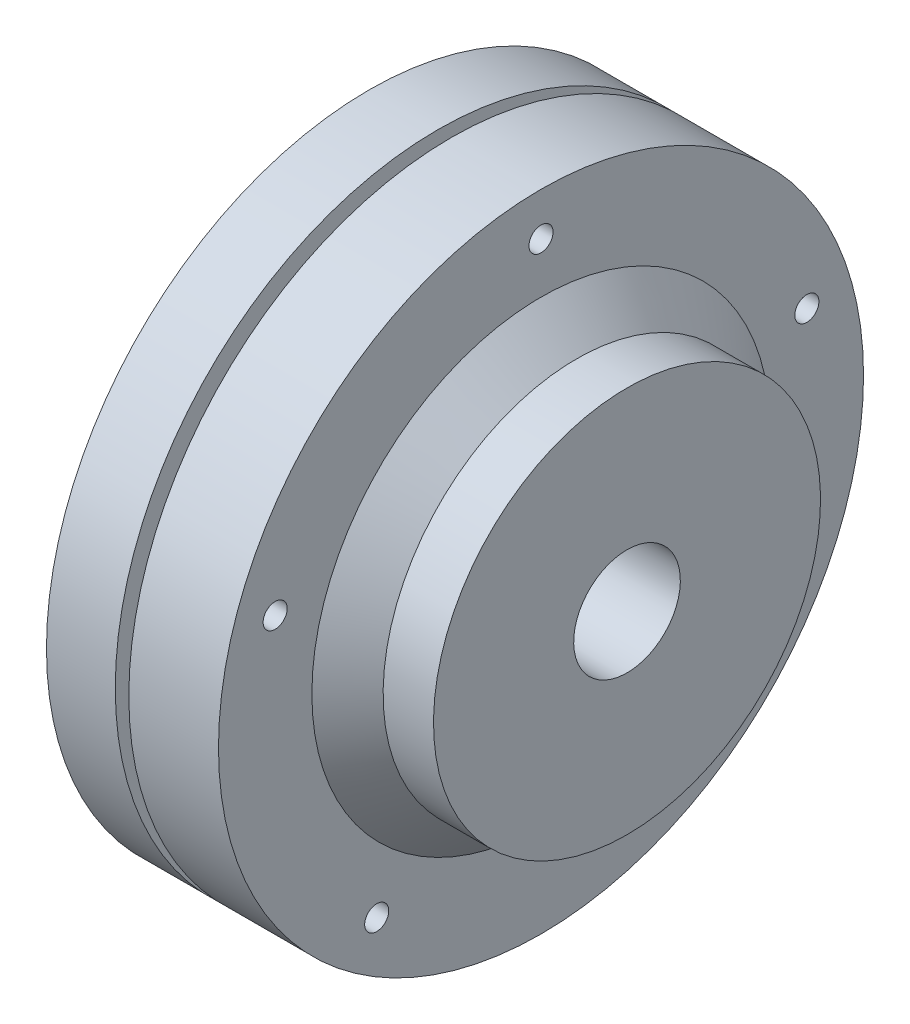
from build123d import *

# Parameters (mm, degrees)
SKETCH2_R                                      = 23.8125
SKETCH2_R_2                                    = 1.4732
BOSS_EXTRUDE1_DEPTH                            = 5.08
CSK_FOR_4_FLAT_HEAD_MACHINE_SCREW1_D           = 3.2639
CSK_FOR_4_FLAT_HEAD_MACHINE_SCREW1_CSINK_D     = 5.715
CSK_FOR_4_FLAT_HEAD_MACHINE_SCREW1_CSINK_ANGLE = 82
BOSS_EXTRUDE2_DEPTH                            = 5.08
BOSS_EXTRUDE2_DEPTH_BACK                       = 3.175
BOSS_EXTRUDE3_START                            = 0.508
SKETCH5_R                                      = 23.8125
BOSS_EXTRUDE3_DEPTH                            = 3.937
SKETCH6_R                                      = 23.8125
BOSS_EXTRUDE4_DEPTH                            = 2.682999968
SKETCH13_W                                     = 0.889
SKETCH13_H                                     = 6.619999968
F_50_0_07_DIAMETER_HOLE1_AT_2_COUNT            = 2
F_50_0_07_DIAMETER_HOLE1_AT_2_PITCH            = 24.260836288
F_50_0_07_DIAMETER_HOLE1_AT_3_COUNT            = 2
F_50_0_07_DIAMETER_HOLE1_AT_3_PITCH            = 39.25485771
F_50_0_07_DIAMETER_HOLE1_AT_4_COUNT            = 2
F_50_0_07_DIAMETER_HOLE1_AT_4_PITCH            = 39.25485771
F_50_0_07_DIAMETER_HOLE1_AT_5_COUNT            = 2
F_50_0_07_DIAMETER_HOLE1_AT_5_PITCH            = 24.260836288
SKETCH15_R                                     = 3.937
CUT_EXTRUDE1_DEPTH                             = 39.690732902


with BuildPart() as part:
    # Sketch2 → Boss-Extrude1 (new body)
    with BuildSketch(Plane.ZY):
        Circle(SKETCH2_R)
        with Locations((19.627428855, 6.377338221)):
            Circle(SKETCH2_R_2, mode=Mode.SUBTRACT)
        with Locations((12.130418144, -16.696088221)):
            Circle(SKETCH2_R_2, mode=Mode.SUBTRACT)
        with Locations((-12.130418144, -16.696088221)):
            Circle(SKETCH2_R_2, mode=Mode.SUBTRACT)
        with Locations((-19.627428855, 6.377338221)):
            Circle(SKETCH2_R_2, mode=Mode.SUBTRACT)
        with Locations((0, 20.6375)):
            Circle(SKETCH2_R_2, mode=Mode.SUBTRACT)
    extrude(amount=BOSS_EXTRUDE1_DEPTH)

    # CSK for #4 Flat Head Machine Screw1 (through all)
    with Locations(Plane.ZY.offset(5.08)):
        with Locations((0, 20.6375), (-19.627428855, 6.377338221), (-12.130418144, -16.696088221), (12.130418144, -16.696088221), (19.627428855, 6.377338221)):
            CounterSinkHole(CSK_FOR_4_FLAT_HEAD_MACHINE_SCREW1_D / 2, CSK_FOR_4_FLAT_HEAD_MACHINE_SCREW1_CSINK_D / 2, counter_sink_angle=CSK_FOR_4_FLAT_HEAD_MACHINE_SCREW1_CSINK_ANGLE)

    # Sketch1 → Boss-Extrude2 (add, two sides: drawn at the far end of the back side and taken through both)
    with BuildSketch(Plane.ZY.offset(-BOSS_EXTRUDE2_DEPTH_BACK)):
        with BuildLine():
            ThreePointArc((-19.77483561, 1.99784305), (-18.90272379, -6.141867272), (-14.823875388, -13.239645718))
            ThreePointArc((-14.823875388, -13.239645718), (-14.519423669, -13.403769568), (-14.180467851, -13.33494776))
            ThreePointArc((-14.180467851, -13.33494776), (-9.816307606, -13.510988315), (-8.300283408, -17.607151831))
            ThreePointArc((-8.300283408, -17.607151831), (-8.260993728, -17.950785078), (-8.010821916, -18.189618811))
            ThreePointArc((-8.010821916, -18.189618811), (0, -19.8755), (8.010821916, -18.189618811))
            ThreePointArc((8.010821916, -18.189618811), (8.260993728, -17.950785078), (8.300283408, -17.607151831))
            ThreePointArc((8.300283408, -17.607151831), (9.816307606, -13.510988315), (14.180467851, -13.33494776))
            ThreePointArc((14.180467851, -13.33494776), (14.519423669, -13.403769568), (14.823875388, -13.239645718))
            ThreePointArc((14.823875388, -13.239645718), (18.90272379, -6.141867272), (19.77483561, 1.99784305))
            ThreePointArc((19.77483561, 1.99784305), (19.624998573, 2.309574265), (19.310325113, 2.453129484))
            ThreePointArc((19.310325113, 2.453129484), (15.88311935, 5.160738315), (17.064294516, 9.365700877))
            ThreePointArc((17.064294516, 9.365700877), (17.234491052, 9.666799908), (17.172480751, 10.007067758))
            ThreePointArc((17.172480751, 10.007067758), (11.682525782, 16.079617272), (4.210698613, 19.42435372))
            ThreePointArc((4.210698613, 19.42435372), (3.86792242, 19.378180473), (3.634153846, 19.123269231))
            ThreePointArc((3.634153846, 19.123269231), (0, 16.7005), (-3.634153846, 19.123269231))
            ThreePointArc((-3.634153846, 19.123269231), (-3.86792242, 19.378180473), (-4.210698613, 19.42435372))
            ThreePointArc((-4.210698613, 19.42435372), (-11.682525782, 16.079617272), (-17.172480751, 10.007067758))
            ThreePointArc((-17.172480751, 10.007067758), (-17.234491052, 9.666799908), (-17.064294516, 9.365700877))
            ThreePointArc((-17.064294516, 9.365700877), (-15.88311935, 5.160738315), (-19.310325113, 2.453129484))
            ThreePointArc((-19.310325113, 2.453129484), (-19.624998573, 2.309574265), (-19.77483561, 1.99784305))
        make_face()
    extrude(amount=BOSS_EXTRUDE2_DEPTH + BOSS_EXTRUDE2_DEPTH_BACK)


with BuildPart() as body_2:
    # Sketch5 → Boss-Extrude3 (new body)
    with BuildSketch(Plane(origin=(3.175, 0, 0), x_dir=(0, 0, -1), z_dir=(1, 0, 0)).offset(BOSS_EXTRUDE3_START)):
        with Locations(Location((0, 0, 0), (0, 0, 180))):
            Circle(SKETCH5_R)
    extrude(amount=BOSS_EXTRUDE3_DEPTH)

    # Sketch6 → Boss-Extrude4 (add)
    with BuildSketch(Plane.ZY.offset(-3.683)):
        Circle(SKETCH6_R)
        with BuildLine():
            ThreePointArc((-4.372131148, 20.169057377), (-12.130418144, 16.696088221), (-17.83085062, 10.390725308))
            ThreePointArc((-17.83085062, 10.390725308), (-17.985876374, 9.540055682), (-17.560385033, 8.787308105))
            ThreePointArc((-17.560385033, 8.787308105), (-16.607824416, 5.396209264), (-19.371700031, 3.212653756))
            ThreePointArc((-19.371700031, 3.212653756), (-20.158383681, 2.853765708), (-20.532976272, 2.074437672))
            ThreePointArc((-20.532976272, 2.074437672), (-19.627428855, -6.377338221), (-15.392202879, -13.747235969))
            ThreePointArc((-15.392202879, -13.747235969), (-14.631073581, -14.157545593), (-13.783684037, -13.985491075))
            ThreePointArc((-13.783684037, -13.985491075), (-10.264199968, -14.127459264), (-9.041599808, -17.430816939))
            ThreePointArc((-9.041599808, -17.430816939), (-8.943375609, -18.289900056), (-8.317946079, -18.886984388))
            ThreePointArc((-8.317946079, -18.886984388), (0, -20.6375), (8.317946079, -18.886984388))
            ThreePointArc((8.317946079, -18.886984388), (8.943375609, -18.289900056), (9.041599808, -17.430816939))
            ThreePointArc((9.041599808, -17.430816939), (10.264199968, -14.127459264), (13.783684037, -13.985491075))
            ThreePointArc((13.783684037, -13.985491075), (14.631073581, -14.157545593), (15.392202879, -13.747235969))
            ThreePointArc((15.392202879, -13.747235969), (19.627428855, -6.377338221), (20.532976272, 2.074437672))
            ThreePointArc((20.532976272, 2.074437672), (20.158383681, 2.853765708), (19.371700031, 3.212653756))
            ThreePointArc((19.371700031, 3.212653756), (16.607824416, 5.396209264), (17.560385033, 8.787308105))
            ThreePointArc((17.560385033, 8.787308105), (17.985876374, 9.540055682), (17.83085062, 10.390725308))
            ThreePointArc((17.83085062, 10.390725308), (12.130418144, 16.696088221), (4.372131148, 20.169057377))
            ThreePointArc((4.372131148, 20.169057377), (3.515190664, 20.05362426), (2.930769231, 19.416346154))
            ThreePointArc((2.930769231, 19.416346154), (0, 17.4625), (-2.930769231, 19.416346154))
            ThreePointArc((-2.930769231, 19.416346154), (-3.515190664, 20.05362426), (-4.372131148, 20.169057377))
        make_face(mode=Mode.SUBTRACT)
    extrude(amount=BOSS_EXTRUDE4_DEPTH)

    # Sketch13 → #50 (0.07) Diameter Hole1 (revolve, cut)
    with BuildSketch(Plane(origin=(1.000000032, 20.6375, 0), x_dir=(0, 0, 1), z_dir=(0, 1, 0))):
        with Locations((0.4445, 3.309999984)):
            Rectangle(SKETCH13_W, SKETCH13_H)
    f_50_0_07_diameter_hole1 = revolve(axis=Axis((-5.349999968, 20.6375, 0), (1, 0, 0)), mode=Mode.SUBTRACT)

    # #50 (0.07) Diameter Hole1 at 2: #50 (0.07) Diameter Hole1 ×2
    with Locations(*[Vector(0, -0.5877852522924741, 0.8090169943749466) * (i * F_50_0_07_DIAMETER_HOLE1_AT_2_PITCH) for i in range(1, F_50_0_07_DIAMETER_HOLE1_AT_2_COUNT)]):
        add(f_50_0_07_diameter_hole1, mode=Mode.SUBTRACT)

    # #50 (0.07) Diameter Hole1 at 3: #50 (0.07) Diameter Hole1 ×2
    with Locations(*[Vector(0, -0.9510565162951545, 0.30901699437494473) * (i * F_50_0_07_DIAMETER_HOLE1_AT_3_PITCH) for i in range(1, F_50_0_07_DIAMETER_HOLE1_AT_3_COUNT)]):
        add(f_50_0_07_diameter_hole1, mode=Mode.SUBTRACT)

    # #50 (0.07) Diameter Hole1 at 4: #50 (0.07) Diameter Hole1 ×2
    with Locations(*[Vector(0, -0.9510565162951522, -0.3090169943749516) * (i * F_50_0_07_DIAMETER_HOLE1_AT_4_PITCH) for i in range(1, F_50_0_07_DIAMETER_HOLE1_AT_4_COUNT)]):
        add(f_50_0_07_diameter_hole1, mode=Mode.SUBTRACT)

    # #50 (0.07) Diameter Hole1 at 5: #50 (0.07) Diameter Hole1 ×2
    with Locations(*[Vector(0, -0.5877852522924685, -0.8090169943749508) * (i * F_50_0_07_DIAMETER_HOLE1_AT_5_PITCH) for i in range(1, F_50_0_07_DIAMETER_HOLE1_AT_5_COUNT)]):
        add(f_50_0_07_diameter_hole1, mode=Mode.SUBTRACT)

    # Sketch14 → Revolve1 (revolve)
    with BuildSketch(Plane.XY, mode=Mode.PRIVATE) as revolve1_sk:
        Polygon((7.62, 0), (7.62, 16.917756121), (10.250256121, 14.2875), (13.97, 14.2875), (13.97, 0), align=None)
    revolve(revolve1_sk.sketch.rotate(Axis((13.97, 0, 0), (1, 0, 0)), 180), axis=Axis((13.97, 0, 0), (1, 0, 0)))


with BuildPart() as cut_extrude1_tool:
    # Sketch15 → Cut-Extrude1 (new, through all)
    with BuildSketch(Plane(origin=(13.97, 0, 0), x_dir=(0, 0, -1), z_dir=(1, 0, 0))):
        with Locations(Location((0, 0, 0), (0, 0, 90))):
            Circle(SKETCH15_R)
    extrude(amount=-CUT_EXTRUDE1_DEPTH)


with BuildPart() as part_1:
    add(part.part)

    # Cut-Extrude1: cut by cut_extrude1_tool
    add(cut_extrude1_tool.part, mode=Mode.SUBTRACT)


with BuildPart() as body_2_1:
    add(body_2.part)

    # Cut-Extrude1: cut by cut_extrude1_tool
    add(cut_extrude1_tool.part, mode=Mode.SUBTRACT)


solid = Compound([part_1.part, body_2_1.part])
